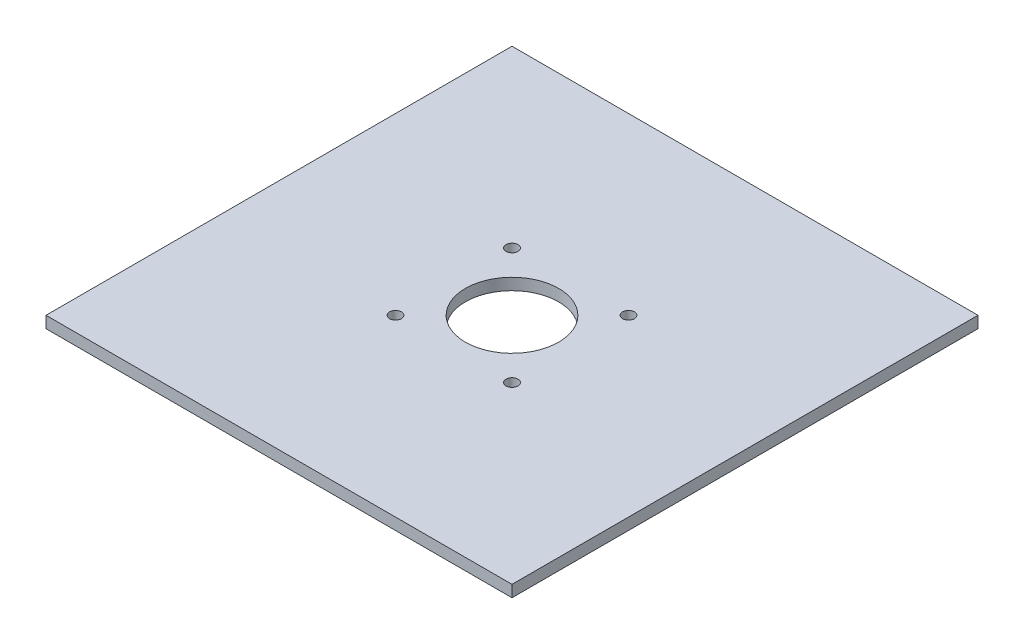
from build123d import *

# Parameters (mm, degrees)
SKETCH1_W           = 200
SKETCH1_H           = 200
SKETCH1_R           = 2.55
SKETCH1_R_2         = 20
BOSS_EXTRUDE1_DEPTH = 5


with BuildPart() as part:
    # Sketch1 → Boss-Extrude1 (new body)
    with BuildSketch(Plane(origin=(0, 0, 0), x_dir=(1, 0, 0), z_dir=(0, 1, 0))):
        Rectangle(SKETCH1_W, SKETCH1_H)
        with Locations(Location((-25.000001323, -25.000001323, 0), (0, 0, 270))):
            Circle(SKETCH1_R, mode=Mode.SUBTRACT)
        with Locations(Location((24.999998677, -24.999998677, 0), (0, 0, 270))):
            Circle(SKETCH1_R, mode=Mode.SUBTRACT)
        with Locations(Location((25.000001323, 25.000001323, 0), (0, 0, 270))):
            Circle(SKETCH1_R, mode=Mode.SUBTRACT)
        with Locations(Location((-24.999998677, 24.999998677, 0), (0, 0, 270))):
            Circle(SKETCH1_R, mode=Mode.SUBTRACT)
        with Locations(Location((0, 0, 0), (0, 0, 270))):
            Circle(SKETCH1_R_2, mode=Mode.SUBTRACT)
    extrude(amount=BOSS_EXTRUDE1_DEPTH)


solid = part.part
